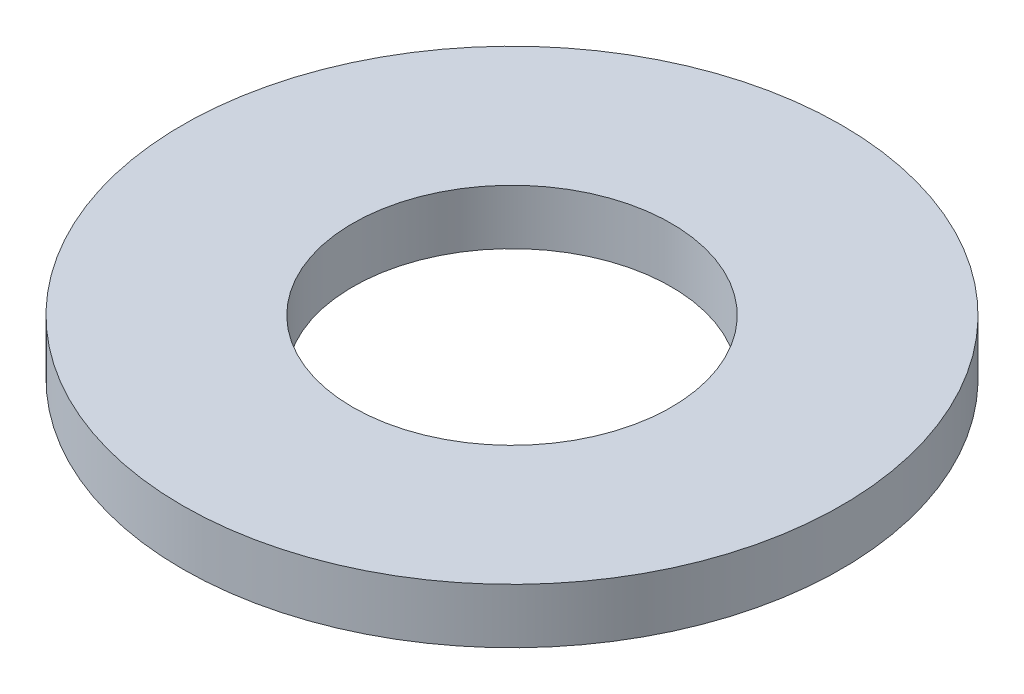
from build123d import *

# Parameters (mm, degrees)
SKETCH1_R      = 3
SKETCH1_R_2    = 1.45
EXTRUDE1_DEPTH = 0.5


with BuildPart() as part:
    # Sketch1 → Extrude1 (new body)
    with BuildSketch(Plane(origin=(0, 0, 0), x_dir=(1, 0, 0), z_dir=(0, 1, 0))):
        with Locations(Location((0, 0, 0), (0, 0, 270))):
            Circle(SKETCH1_R)
        with Locations(Location((0, 0, 0), (0, 0, 270))):
            Circle(SKETCH1_R_2, mode=Mode.SUBTRACT)
    extrude(amount=EXTRUDE1_DEPTH)


solid = part.part
